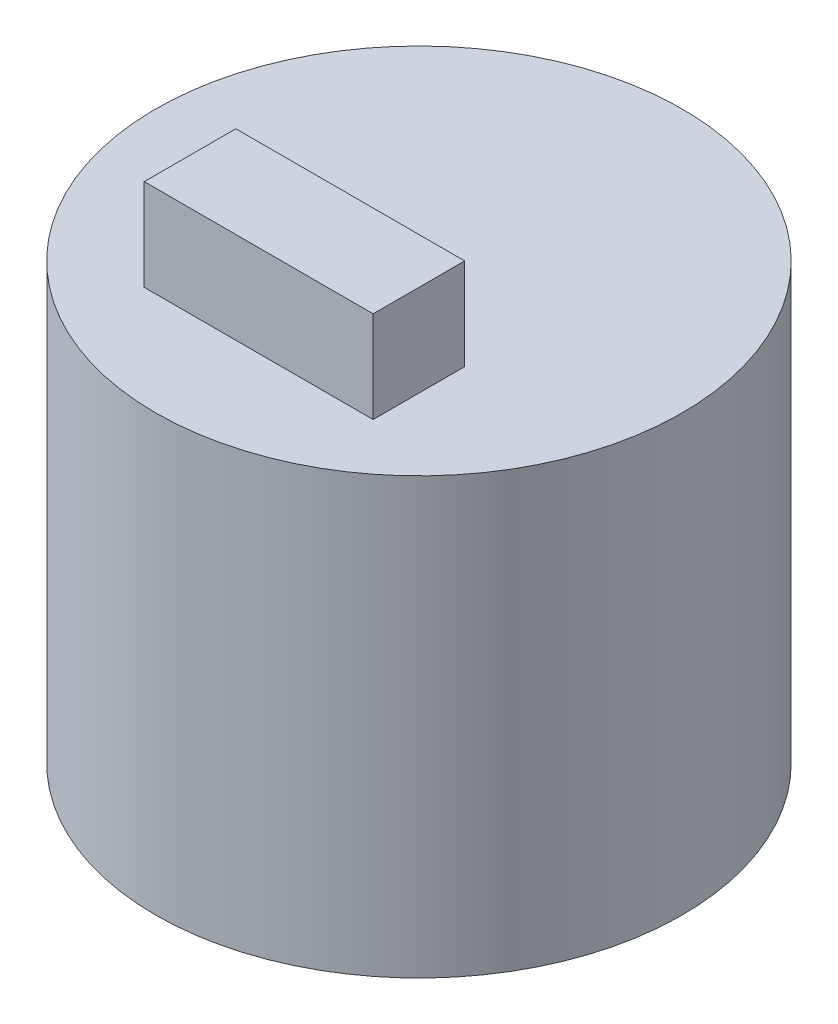
from build123d import *

# Parameters (mm, degrees)
SKETCH1_R           = 11.5
BOSS_EXTRUDE1_DEPTH = 19
SKETCH2_W           = 10
SKETCH2_H           = 4
BOSS_EXTRUDE2_DEPTH = 4
SKETCH3_R           = 3.5
SKETCH3_R_2         = 1.25
CUT_EXTRUDE1_DEPTH  = 9


with BuildPart() as part:
    # Sketch1 → Boss-Extrude1 (new body)
    with BuildSketch(Plane(origin=(0, 0, 0), x_dir=(1, 0, 0), z_dir=(0, 1, 0))):
        with Locations(Location((0, 0, 0), (0, 0, 270))):
            Circle(SKETCH1_R)
    extrude(amount=BOSS_EXTRUDE1_DEPTH)

    # Sketch2 → Boss-Extrude2 (add)
    with BuildSketch(Plane(origin=(0, 19, 0), x_dir=(1, 0, 0), z_dir=(0, 1, 0))):
        with Locations((0, -5)):
            Rectangle(SKETCH2_W, SKETCH2_H)
    extrude(amount=BOSS_EXTRUDE2_DEPTH)

    # Sketch3 → Cut-Extrude1 (cut)
    with BuildSketch(Plane.XZ):
        with Locations(Location((0, 0, 0), (0, 0, 270))):
            Circle(SKETCH3_R)
        with Locations(Location((0, 8.5, 0), (0, 0, 270))):
            Circle(SKETCH3_R_2)
        with Locations(Location((0, -8.5, 0), (0, 0, 270))):
            Circle(SKETCH3_R_2)
    extrude(amount=-CUT_EXTRUDE1_DEPTH, mode=Mode.SUBTRACT)


solid = part.part
